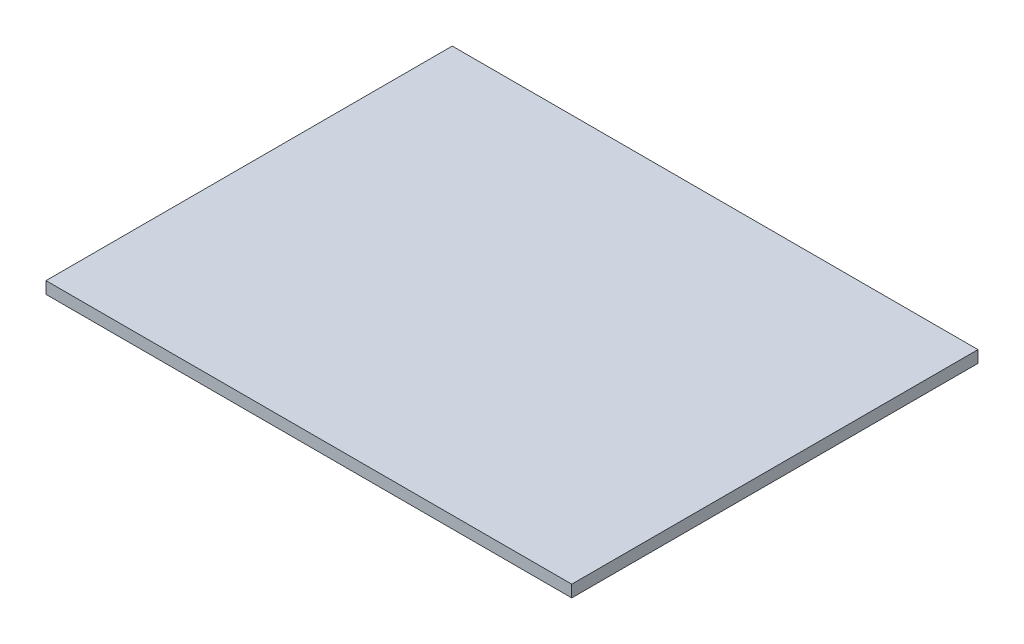
from build123d import *

# Parameters (mm, degrees)
SKETCH1_W           = 279.4
SKETCH1_H           = 215.9
BOSS_EXTRUDE1_DEPTH = 6.35


with BuildPart() as part:
    # Sketch1 → Boss-Extrude1 (new body)
    with BuildSketch(Plane(origin=(0, 0, 0), x_dir=(1, 0, 0), z_dir=(0, 1, 0))):
        Rectangle(SKETCH1_W, SKETCH1_H)
    extrude(amount=BOSS_EXTRUDE1_DEPTH)


solid = part.part
